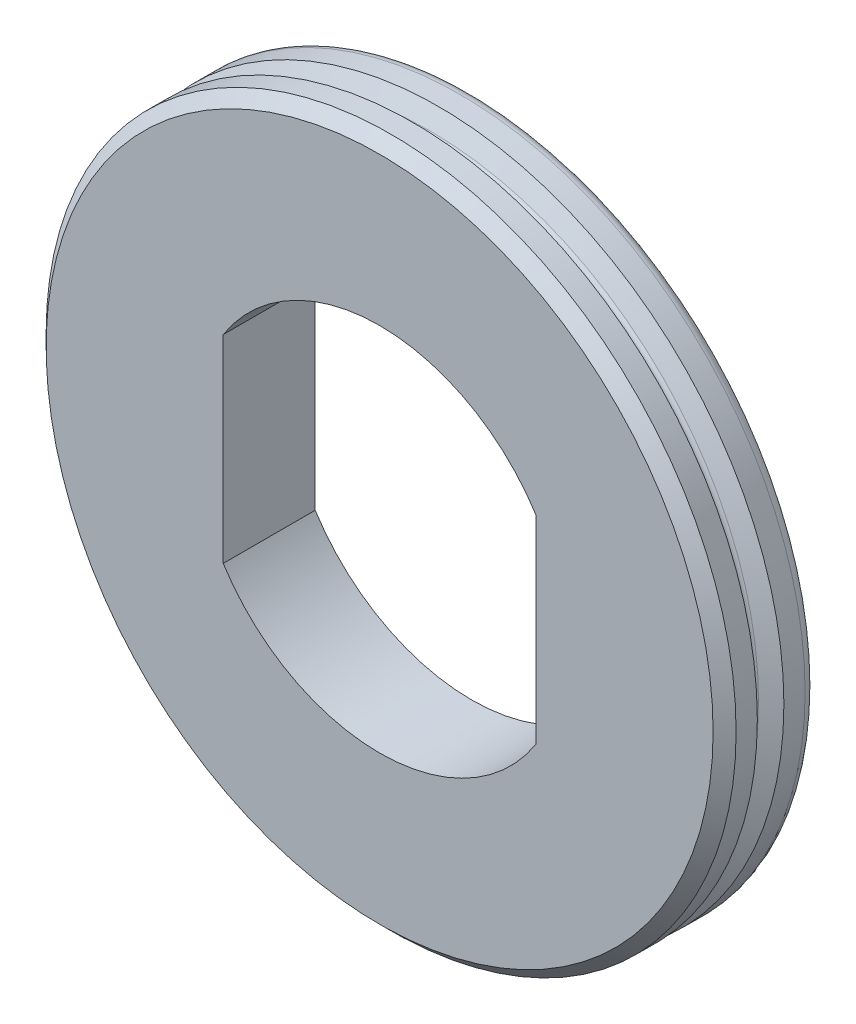
from build123d import *

# Parameters (mm, degrees)
SKETCH_1_R      = 15
EXTRUDE_2_DEPTH = 2
FILLET_1_R      = 0.2
CHAMFER_1_SIZE  = 0.5
FILLET_2_R      = 0.5


with BuildPart() as part:
    # Эскиз1 → Бобышка-Вытянуть2 (new, symmetric)
    with BuildSketch(Plane.XY):
        Circle(SKETCH_1_R)
        with BuildLine():
            Line((6.8, 4.308421985), (6.8, -4.308421985))
            ThreePointArc((6.8, -4.308421985), (0, -8.05), (-6.8, -4.308421985))
            Line((-6.8, -4.308421985), (-6.8, 4.308421985))
            ThreePointArc((-6.8, 4.308421985), (0, 8.05), (6.8, 4.308421985))
        make_face(mode=Mode.SUBTRACT)
    extrude(amount=EXTRUDE_2_DEPTH, both=True)

    # Эскиз2 → Вырез-Повернуть1 (revolve, cut)
    with BuildSketch(Plane(origin=(0, 0, 0), x_dir=(0, 0, -1), z_dir=(1, 0, 0)), mode=Mode.PRIVATE) as cut_revolve_1_sk:
        Polygon((-0.577350269, 15), (0.577350269, 15), (0, 14), align=None)
    revolve(cut_revolve_1_sk.sketch.rotate(Axis((0, 0, 3.24866267), (0, 0, -1)), 90), axis=Axis((0, 0, 3.24866267), (0, 0, -1)), mode=Mode.SUBTRACT)

    # Скругление1
    fillet_1_edges = [part.edges().sort_by_distance(p)[0] for p in [
        (-14, 0, 0),
    ]]
    fillet(fillet_1_edges, radius=FILLET_1_R)

    # Фаска1
    chamfer_1_edges = [part.edges().sort_by_distance(p)[0] for p in [
        (-15, 0, 2),
    ]]
    chamfer(chamfer_1_edges, length=CHAMFER_1_SIZE)

    # Скругление2
    fillet_2_edges = [part.edges().sort_by_distance(p)[0] for p in [
        (-15, 0, -2),
    ]]
    fillet(fillet_2_edges, radius=FILLET_2_R)


solid = part.part
